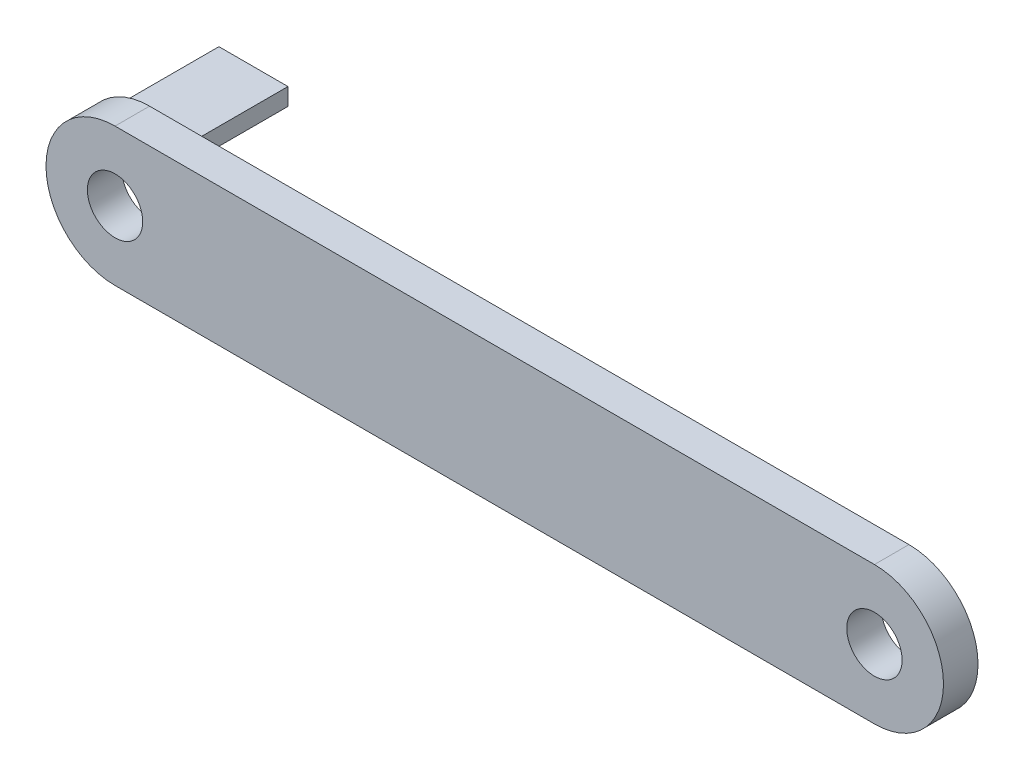
from build123d import *

# Parameters (mm, degrees)
SKETCH1_R           = 4.01
BOSS_EXTRUDE1_DEPTH = 5
SKETCH2_R           = 1.49
BOSS_EXTRUDE3_DEPTH = 4
SKETCH4_W           = 10
SKETCH4_H           = 2.5
BOSS_EXTRUDE5_DEPTH = 15


with BuildPart() as part:
    # Sketch1 → Boss-Extrude1 (new body)
    with BuildSketch(Plane.XY):
        with BuildLine():
            Line((110, 10), (0, 10))
            ThreePointArc((0, 10), (-10, 0), (0, -10))
            Line((0, -10), (110, -10))
            ThreePointArc((110, -10), (120, 0), (110, 10))
        make_face()
        Circle(SKETCH1_R, mode=Mode.SUBTRACT)
        with Locations((110, 0)):
            Circle(SKETCH1_R, mode=Mode.SUBTRACT)
    extrude(amount=BOSS_EXTRUDE1_DEPTH)

    # Sketch2 → Boss-Extrude3 (add)
    with BuildSketch(Plane(origin=(0, 0, 0), x_dir=(-1, 0, 0), z_dir=(0, 0, -1))):
        with Locations(Location((-20, 0, 0), (0, 0, 180))):
            Circle(SKETCH2_R)
    extrude(amount=BOSS_EXTRUDE3_DEPTH)

    # Sketch4 → Boss-Extrude5 (add)
    with BuildSketch(Plane(origin=(0, 0, 0), x_dir=(-1, 0, 0), z_dir=(0, 0, -1))):
        with Locations((-0.046889456, 6.235161972)):
            Rectangle(SKETCH4_W, SKETCH4_H)
    extrude(amount=BOSS_EXTRUDE5_DEPTH)


solid = part.part
